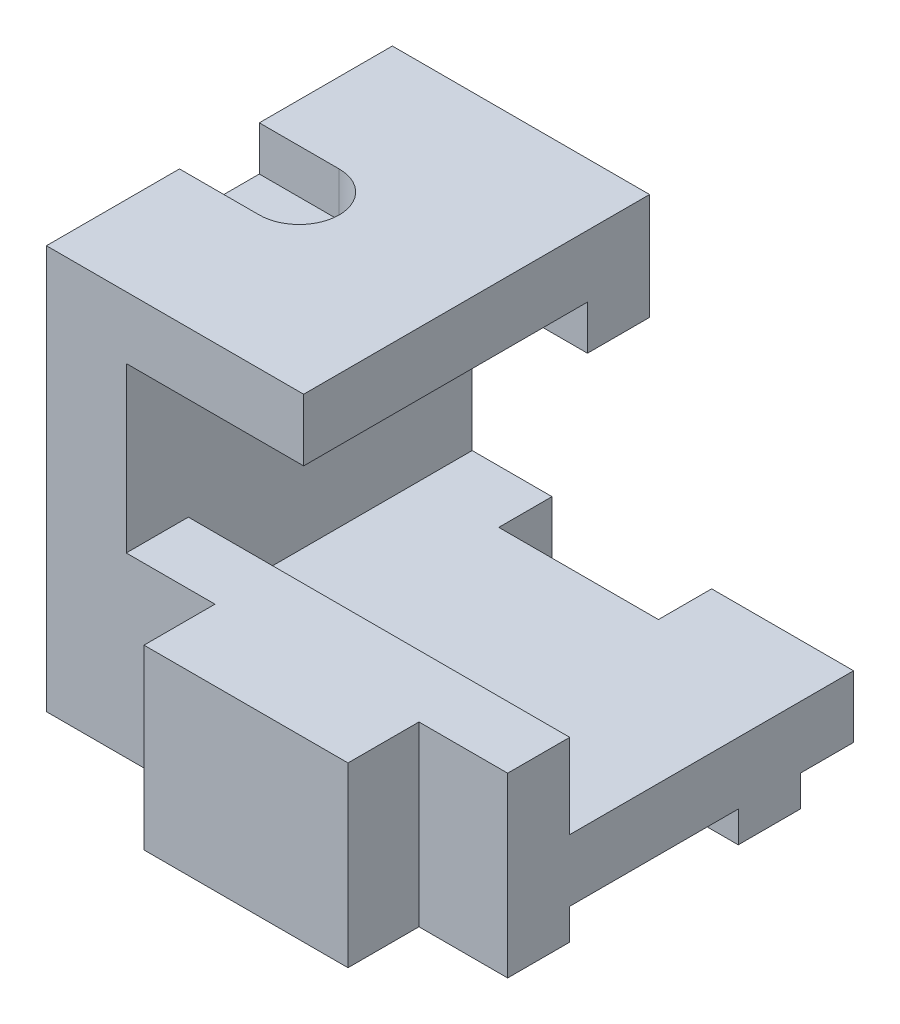
from build123d import *

# Parameters (mm, degrees)
SKETCH_1_W          = 20
SKETCH_1_H          = 7
SKETCH_1_W_2        = 50
EXTRUDE_1_DEPTH     = 39
CUT_EXTRUDE_1_DEPTH = 5
EXTRUDE_2_REACH     = 60.949
SKETCH_3_W          = 7
SKETCH_3_H          = 5
EXTRUDE_3_REACH     = 74.429
SKETCH_4_W          = 7
SKETCH_4_H          = 14
SKETCH_4_H_2        = 3.5
CUT_EXTRUDE_2_REACH = 78.059
SKETCH_5_W          = 18
SKETCH_5_H          = 6
SKETCH_6_W          = 23
SKETCH_6_H          = 14
EXTRUDE_4_DEPTH     = 8
EXTRUDE_5_DEPTH     = 2
EXTRUDE_6_DEPTH     = 6


with BuildPart() as part:
    # Эскиз1 → Бобышка-Вытянуть1 (new body)
    with BuildSketch(Plane.XY):
        with Locations((17, 31.5)):
            Rectangle(SKETCH_1_W, SKETCH_1_H)
        Polygon((0, 35), (0, 0), (7, 0), (7, 28), (7, 35), align=None)
        with Locations((25, -3.5)):
            Rectangle(SKETCH_1_W_2, SKETCH_1_H)
    extrude(amount=EXTRUDE_1_DEPTH)

    # Эскиз2 → Вырез-Вытянуть1 (cut)
    with BuildSketch(Plane(origin=(0, 35, 0), x_dir=(1, 0, 0), z_dir=(0, 1, 0))):
        with BuildLine():
            ThreePointArc((7, -15), (3.818019485, -16.318019485), (2.5, -19.5))
            Line((2.5, -19.5), (11.5, -19.5))
            ThreePointArc((11.5, -19.5), (10.181980515, -16.318019485), (7, -15))
        make_face()
        with BuildLine():
            Line((11.5, -19.5), (2.5, -19.5))
            ThreePointArc((2.5, -19.5), (3.818019485, -22.681980515), (7, -24))
            ThreePointArc((7, -24), (10.181980515, -22.681980515), (11.5, -19.5))
        make_face()
        with BuildLine():
            Line((0, -15), (0, -19.5))
            Line((0, -19.5), (2.5, -19.5))
            ThreePointArc((2.5, -19.5), (3.818019485, -16.318019485), (7, -15))
            Line((7, -15), (0, -15))
        make_face()
        with BuildLine():
            Line((2.5, -19.5), (0, -19.5))
            Line((0, -19.5), (0, -24))
            Line((0, -24), (7, -24))
            ThreePointArc((7, -24), (3.818019485, -22.681980515), (2.5, -19.5))
        make_face()
    extrude(amount=-CUT_EXTRUDE_1_DEPTH, mode=Mode.SUBTRACT)

    # Эскиз3 → Бобышка-Вытянуть2 (add, up to next)
    with BuildSketch(Plane(origin=(27, 0, 0), x_dir=(0, 0, -1), z_dir=(1, 0, 0)), mode=Mode.PRIVATE) as extrude_2_sk1:
        with Locations((-3.5, 25.5)):
            Rectangle(SKETCH_3_W, SKETCH_3_H)
    extrude_2_tool1 = extrude(extrude_2_sk1.sketch, amount=-EXTRUDE_2_REACH, mode=Mode.PRIVATE) - part.part
    add(extrude_2_tool1.solids().sort_by_distance((27, 25.5, 3.5))[0])

    # Бобышка-Вытянуть3: up to this face of the body (flat: up to its plane)
    extrude_3_end = Plane(part.part.faces().sort_by_distance((0, 13.47740113, 19.5))[0])
    # Эскиз4 → Бобышка-Вытянуть3 (add, up to the picked face)
    with BuildSketch(Plane(origin=(50, 0, 0), x_dir=(0, 0, -1), z_dir=(1, 0, 0)), mode=Mode.PRIVATE) as extrude_3_sk1:
        with Locations((-35.5, -3.5)):
            Rectangle(SKETCH_4_W, SKETCH_4_H)
    extrude_3_tool1 = split(extrude(extrude_3_sk1.sketch, amount=-EXTRUDE_3_REACH, mode=Mode.PRIVATE), bisect_by=extrude_3_end, keep=Keep.BOTH, mode=Mode.PRIVATE)
    # Эскиз4 → Бобышка-Вытянуть3 (add, up to the picked face)
    with BuildSketch(Plane(origin=(50, 0, 0), x_dir=(0, 0, -1), z_dir=(1, 0, 0)), mode=Mode.PRIVATE) as extrude_3_sk2:
        with Locations((-9.5, -8.75)):
            Rectangle(SKETCH_4_W, SKETCH_4_H_2)
    extrude_3_tool2 = split(extrude(extrude_3_sk2.sketch, amount=-EXTRUDE_3_REACH, mode=Mode.PRIVATE), bisect_by=extrude_3_end, keep=Keep.BOTH, mode=Mode.PRIVATE)
    add(extrude_3_tool1.solids().sort_by(Axis((50, -3.5, 35.5), (-1, 0, 0)))[0])
    add(extrude_3_tool2.solids().sort_by(Axis((50, -8.75, 9.5), (-1, 0, 0)))[0])

    # Эскиз5 → Вырез-Вытянуть2 (cut, up to next)
    with BuildSketch(Plane.XZ.offset(7), mode=Mode.PRIVATE) as cut_extrude_2_sk1:
        with Locations((25, 3)):
            Rectangle(SKETCH_5_W, SKETCH_5_H)
    cut_extrude_2_tool1 = extrude(cut_extrude_2_sk1.sketch, amount=-CUT_EXTRUDE_2_REACH, mode=Mode.PRIVATE) & part.part
    add(cut_extrude_2_tool1.solids().sort_by_distance((25, -7, 3))[0], mode=Mode.SUBTRACT)

    # Эскиз6 → Бобышка-Вытянуть4 (add)
    with BuildSketch(Plane.XY.offset(39)):
        with Locations((28.5, -3.5)):
            Rectangle(SKETCH_6_W, SKETCH_6_H)
    extrude(amount=EXTRUDE_4_DEPTH)

    # Эскиз7 → Бобышка-Вытянуть5 (add)
    with BuildSketch(Plane.ZY):
        Polygon((39, -10.5), (39, 35), (24, 35), (24, 30), (15, 30), (15, 35), (0, 35), (0, -7), (6, -7), (6, -10.5), (13, -10.5), (13, -7), (32, -7), (32, -10.5), align=None)
    extrude(amount=EXTRUDE_5_DEPTH)

    # Эскиз8 → Бобышка-Вытянуть6 (add)
    with BuildSketch(Plane(origin=(0, 3.5, 0), x_dir=(1, 0, 0), z_dir=(0, 1, 0))):
        Polygon((7, -32), (7, -39), (17, -39), (17, -47), (40, -47), (40, -39), (50, -39), (50, -32), align=None)
    extrude(amount=EXTRUDE_6_DEPTH)


solid = part.part
